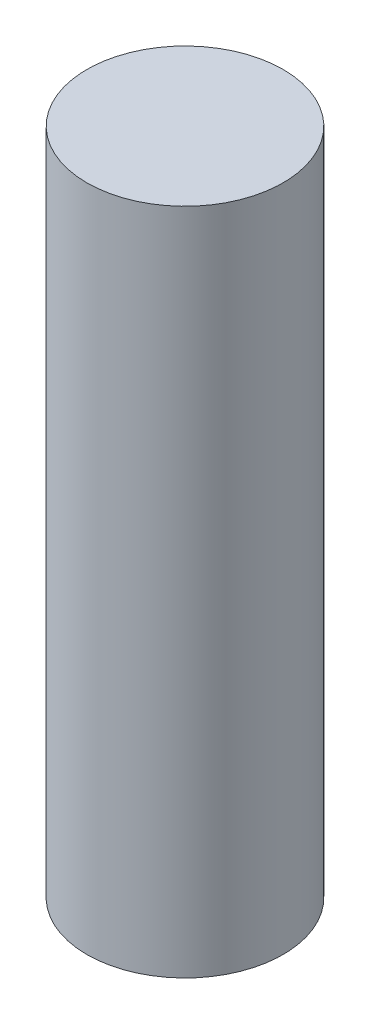
from build123d import *

# Parameters (mm, degrees)
SKETCH1_R           = 13
BOSS_EXTRUDE1_DEPTH = 88.5


with BuildPart() as part:
    # Sketch1 → Boss-Extrude1 (new body)
    with BuildSketch(Plane(origin=(0, 0, 0), x_dir=(1, 0, 0), z_dir=(0, 1, 0))):
        with Locations(Location((0, 0, 0), (0, 0, 270))):
            Circle(SKETCH1_R)
    extrude(amount=BOSS_EXTRUDE1_DEPTH)


solid = part.part
